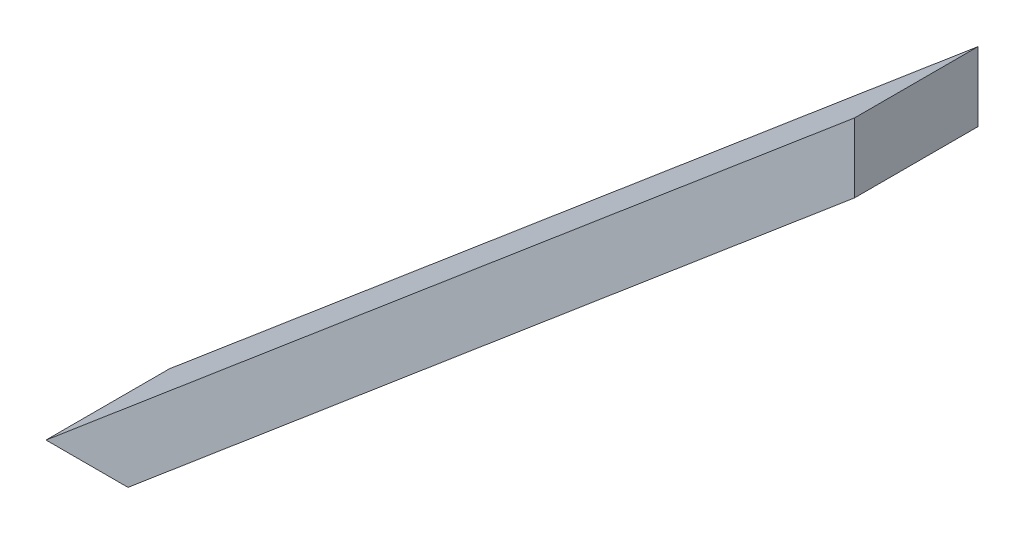
from build123d import *

# Parameters (mm, degrees)
BOSS_EXTRUDE1_DEPTH = 44.45


with BuildPart() as part:
    # Sketch1 → Boss-Extrude1 (new, symmetric)
    with BuildSketch(Plane.XY):
        Polygon((-414.644303086, 88.9), (-414.644303078, 39.018282941), (-937.636106933, -402.928949297), (-996.665165799, -402.928949297), align=None)
    extrude(amount=BOSS_EXTRUDE1_DEPTH, both=True)


solid = part.part
